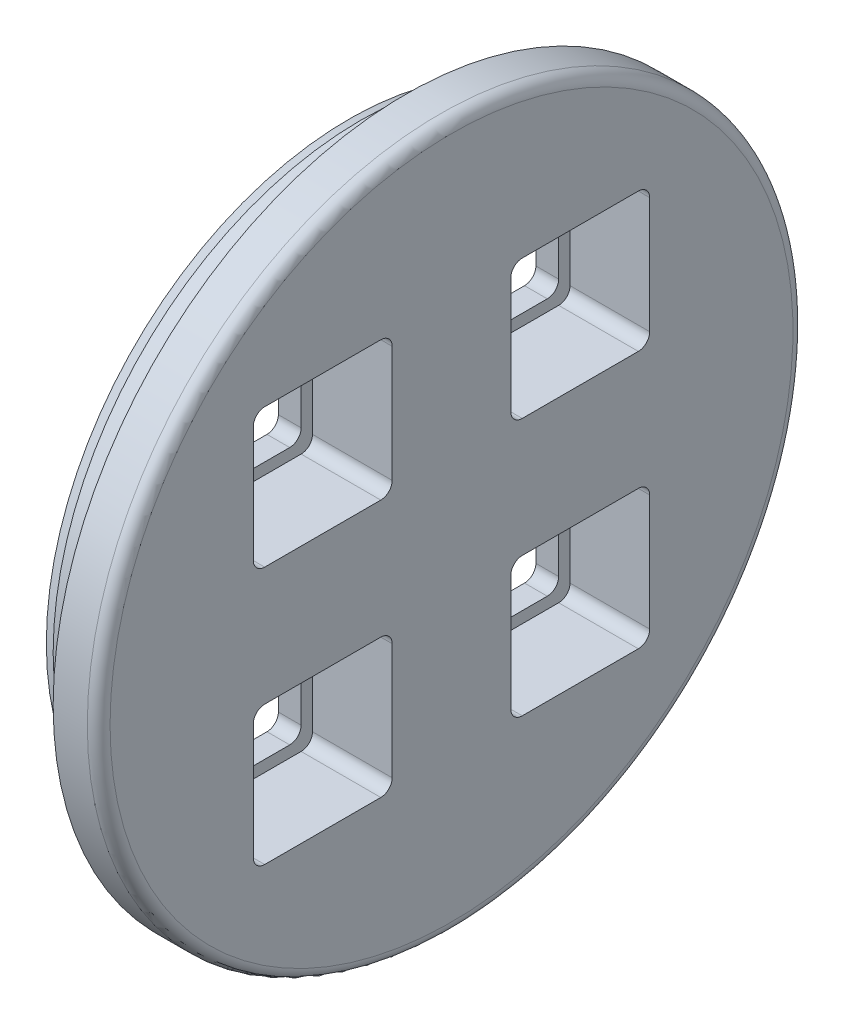
from build123d import *

# Parameters (mm, degrees)
CUT_EXTRUDE1_START = -10
CUT_EXTRUDE1_DEPTH = 214.774440026
CUT_EXTRUDE2_DEPTH = 224.774440026


with BuildPart() as part:
    # Çizim1 → Döndür1 (revolve)
    with BuildSketch(Plane.XY, mode=Mode.PRIVATE) as d_nd_r1_sk:
        with BuildLine():
            Line((0, 31), (5, 31))
            Line((5, 31), (5, 32.75))
            Line((5, 32.75), (7.3, 32.75))
            Line((7.3, 32.75), (7.3, 31))
            Line((7.3, 31), (25, 31))
            Line((25, 31), (25, 16))
            Line((25, 16), (35, 16))
            Line((35, 16), (35, 0))
            Line((35, 0), (45, 0))
            Line((45, 0), (45, 148.5))
            Line((45, 148.5), (45, 150))
            ThreePointArc((45, 150), (43.535533906, 153.535533906), (40, 155))
            Line((40, 155), (25, 155))
            Line((25, 155), (25, 135))
            Line((25, 135), (5, 135))
            Line((5, 135), (0, 133))
            Line((0, 133), (0, 31))
        make_face()
    revolve(d_nd_r1_sk.sketch.rotate(Axis((0, 0, 0), (1, 0, 0)), 90), axis=Axis((0, 0, 0), (1, 0, 0)))

    # Sketch2 → Cut-Extrude1 (cut, through all)
    with BuildSketch(Plane.ZY.offset(CUT_EXTRUDE1_START)):
        with BuildLine():
            Line((82.068542495, 87.068542495), (31.068542495, 87.068542495))
            ThreePointArc((31.068542495, 87.068542495), (27.533008589, 85.604076401), (26.068542495, 82.068542495))
            Line((26.068542495, 82.068542495), (26.068542495, 31.068542495))
            ThreePointArc((26.068542495, 31.068542495), (27.533008589, 27.533008589), (31.068542495, 26.068542495))
            Line((31.068542495, 26.068542495), (82.068542495, 26.068542495))
            ThreePointArc((82.068542495, 26.068542495), (85.604076401, 27.533008589), (87.068542495, 31.068542495))
            Line((87.068542495, 31.068542495), (87.068542495, 82.068542495))
            ThreePointArc((87.068542495, 82.068542495), (85.604076401, 85.604076401), (82.068542495, 87.068542495))
        make_face()
        with BuildLine():
            Line((-82.068542495, 87.068542495), (-31.068542495, 87.068542495))
            ThreePointArc((-31.068542495, 87.068542495), (-27.533008589, 85.604076401), (-26.068542495, 82.068542495))
            Line((-26.068542495, 82.068542495), (-26.068542495, 31.068542495))
            ThreePointArc((-26.068542495, 31.068542495), (-27.533008589, 27.533008589), (-31.068542495, 26.068542495))
            Line((-31.068542495, 26.068542495), (-82.068542495, 26.068542495))
            ThreePointArc((-82.068542495, 26.068542495), (-85.604076401, 27.533008589), (-87.068542495, 31.068542495))
            Line((-87.068542495, 31.068542495), (-87.068542495, 82.068542495))
            ThreePointArc((-87.068542495, 82.068542495), (-85.604076401, 85.604076401), (-82.068542495, 87.068542495))
        make_face()
        with BuildLine():
            Line((87.068542495, -82.068542495), (87.068542495, -31.068542495))
            ThreePointArc((87.068542495, -31.068542495), (85.604076401, -27.533008589), (82.068542495, -26.068542495))
            Line((82.068542495, -26.068542495), (31.068542495, -26.068542495))
            ThreePointArc((31.068542495, -26.068542495), (27.533008589, -27.533008589), (26.068542495, -31.068542495))
            Line((26.068542495, -31.068542495), (26.068542495, -82.068542495))
            ThreePointArc((26.068542495, -82.068542495), (27.533008589, -85.604076401), (31.068542495, -87.068542495))
            Line((31.068542495, -87.068542495), (82.068542495, -87.068542495))
            ThreePointArc((82.068542495, -87.068542495), (85.604076401, -85.604076401), (87.068542495, -82.068542495))
        make_face()
        with BuildLine():
            Line((-82.068542495, -87.068542495), (-31.068542495, -87.068542495))
            ThreePointArc((-31.068542495, -87.068542495), (-27.533008589, -85.604076401), (-26.068542495, -82.068542495))
            Line((-26.068542495, -82.068542495), (-26.068542495, -31.068542495))
            ThreePointArc((-26.068542495, -31.068542495), (-27.533008589, -27.533008589), (-31.068542495, -26.068542495))
            Line((-31.068542495, -26.068542495), (-82.068542495, -26.068542495))
            ThreePointArc((-82.068542495, -26.068542495), (-85.604076401, -27.533008589), (-87.068542495, -31.068542495))
            Line((-87.068542495, -31.068542495), (-87.068542495, -82.068542495))
            ThreePointArc((-87.068542495, -82.068542495), (-85.604076401, -85.604076401), (-82.068542495, -87.068542495))
        make_face()
    extrude(amount=-CUT_EXTRUDE1_DEPTH, mode=Mode.SUBTRACT)

    # Sketch4 → Cut-Extrude2 (cut, through all)
    with BuildSketch(Plane.ZY):
        with BuildLine():
            Line((36.068542495, -31.068542495), (77.068542495, -31.068542495))
            ThreePointArc((77.068542495, -31.068542495), (80.604076401, -32.533008589), (82.068542495, -36.068542495))
            Line((82.068542495, -36.068542495), (82.068542495, -77.068542495))
            ThreePointArc((82.068542495, -77.068542495), (80.604076401, -80.604076401), (77.068542495, -82.068542495))
            Line((77.068542495, -82.068542495), (36.068542495, -82.068542495))
            ThreePointArc((36.068542495, -82.068542495), (32.533008589, -80.604076401), (31.068542495, -77.068542495))
            Line((31.068542495, -77.068542495), (31.068542495, -36.068542495))
            ThreePointArc((31.068542495, -36.068542495), (32.533008589, -32.533008589), (36.068542495, -31.068542495))
        make_face()
        with BuildLine():
            Line((-36.068542495, -31.068542495), (-77.068542495, -31.068542495))
            ThreePointArc((-77.068542495, -31.068542495), (-80.604076401, -32.533008589), (-82.068542495, -36.068542495))
            Line((-82.068542495, -36.068542495), (-82.068542495, -77.068542495))
            ThreePointArc((-82.068542495, -77.068542495), (-80.604076401, -80.604076401), (-77.068542495, -82.068542495))
            Line((-77.068542495, -82.068542495), (-36.068542495, -82.068542495))
            ThreePointArc((-36.068542495, -82.068542495), (-32.533008589, -80.604076401), (-31.068542495, -77.068542495))
            Line((-31.068542495, -77.068542495), (-31.068542495, -36.068542495))
            ThreePointArc((-31.068542495, -36.068542495), (-32.533008589, -32.533008589), (-36.068542495, -31.068542495))
        make_face()
        with BuildLine():
            Line((-31.068542495, 36.068542495), (-31.068542495, 77.068542495))
            ThreePointArc((-31.068542495, 77.068542495), (-32.533008589, 80.604076401), (-36.068542495, 82.068542495))
            Line((-36.068542495, 82.068542495), (-77.068542495, 82.068542495))
            ThreePointArc((-77.068542495, 82.068542495), (-80.604076401, 80.604076401), (-82.068542495, 77.068542495))
            Line((-82.068542495, 77.068542495), (-82.068542495, 36.068542495))
            ThreePointArc((-82.068542495, 36.068542495), (-80.604076401, 32.533008589), (-77.068542495, 31.068542495))
            Line((-77.068542495, 31.068542495), (-36.068542495, 31.068542495))
            ThreePointArc((-36.068542495, 31.068542495), (-32.533008589, 32.533008589), (-31.068542495, 36.068542495))
        make_face()
        with BuildLine():
            Line((36.068542495, 31.068542495), (77.068542495, 31.068542495))
            ThreePointArc((77.068542495, 31.068542495), (80.604076401, 32.533008589), (82.068542495, 36.068542495))
            Line((82.068542495, 36.068542495), (82.068542495, 77.068542495))
            ThreePointArc((82.068542495, 77.068542495), (80.604076401, 80.604076401), (77.068542495, 82.068542495))
            Line((77.068542495, 82.068542495), (36.068542495, 82.068542495))
            ThreePointArc((36.068542495, 82.068542495), (32.533008589, 80.604076401), (31.068542495, 77.068542495))
            Line((31.068542495, 77.068542495), (31.068542495, 36.068542495))
            ThreePointArc((31.068542495, 36.068542495), (32.533008589, 32.533008589), (36.068542495, 31.068542495))
        make_face()
    extrude(amount=-CUT_EXTRUDE2_DEPTH, mode=Mode.SUBTRACT)


solid = part.part
